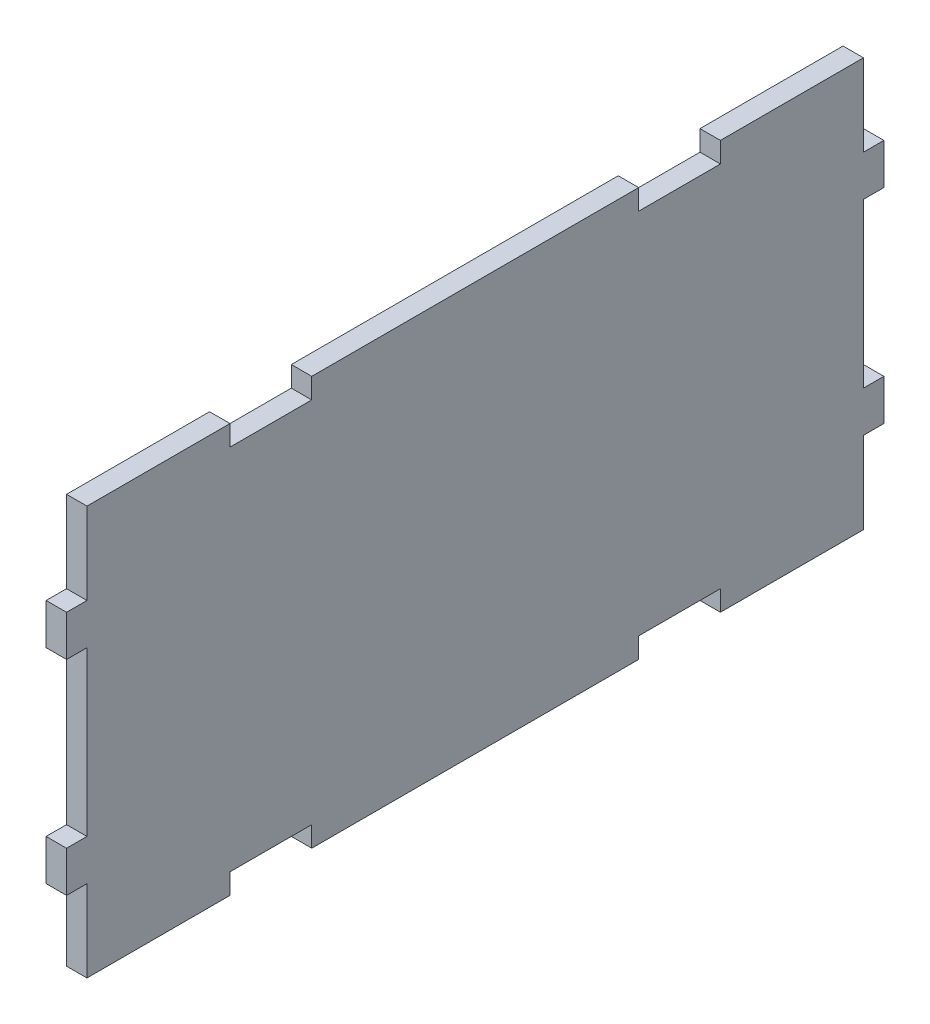
from build123d import *

# Parameters (mm, degrees)
BOSS_EXTRUDE1_DEPTH = 5


with BuildPart() as part:
    # Sketch1 → Boss-Extrude1 (new body)
    with BuildSketch(Plane(origin=(0, 0, 0), x_dir=(0, 0, -1), z_dir=(1, 0, 0))):
        Polygon((113.849232456, -41.617789072), (113.849232456, -61.617789072), (78.849232456, -61.617789072), (78.849232456, -56.617789072), (58.849232456, -56.617789072), (58.849232456, -61.617789072), (-21.150767544, -61.617789072), (-21.150767544, -56.617789072), (-41.150767544, -56.617789072), (-41.150767544, -61.617789072), (-76.150767544, -61.617789072), (-76.150767544, -41.617789072), (-81.150767544, -41.617789072), (-81.150767544, -31.617789072), (-76.150767544, -31.617789072), (-76.150767544, 8.382210928), (-81.150767544, 8.382210928), (-81.150767544, 18.382210928), (-76.150767544, 18.382210928), (-76.150767544, 38.382210928), (-41.150767544, 38.382210928), (-41.150767544, 33.382210928), (-21.150767544, 33.382210928), (-21.150767544, 38.382210928), (58.849232456, 38.382210928), (58.849232456, 33.382210928), (78.849232456, 33.382210928), (78.849232456, 38.382210928), (113.849232456, 38.382210928), (113.849232456, 18.382210928), (118.849232456, 18.382210928), (118.849232456, 8.382210928), (113.849232456, 8.382210928), (113.849232456, -31.617789072), (118.849232456, -31.617789072), (118.849232456, -41.617789072), align=None)
    extrude(amount=BOSS_EXTRUDE1_DEPTH)


solid = part.part
